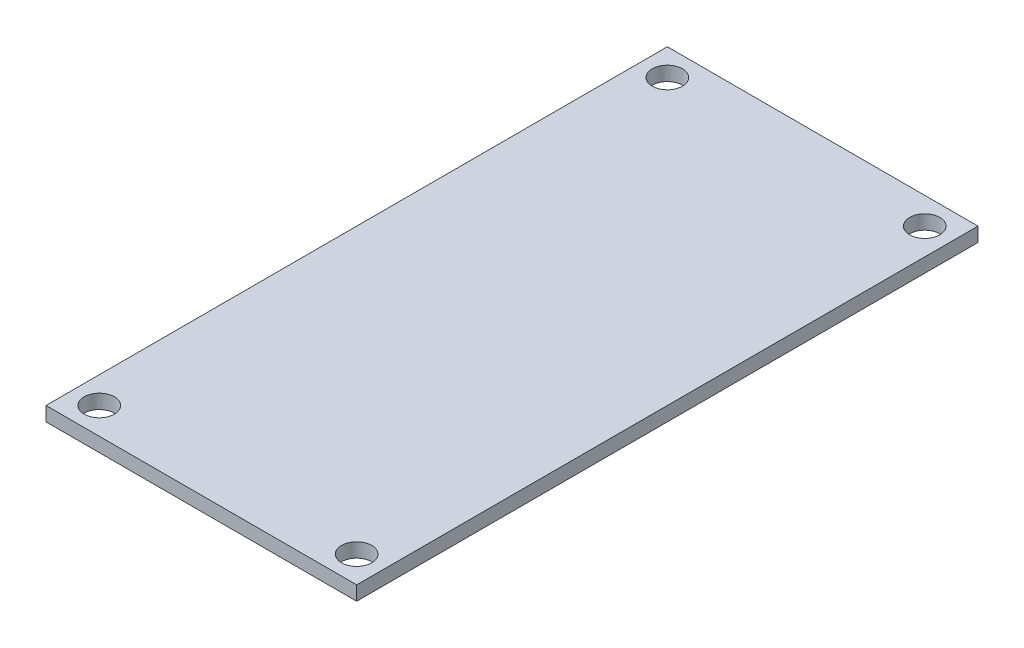
from build123d import *

# Parameters (mm, degrees)
SKETCH1_W           = 35
SKETCH1_H           = 70
SKETCH1_R           = 1.7
BOSS_EXTRUDE1_DEPTH = 1.6


with BuildPart() as part:
    # Sketch1 → Boss-Extrude1 (new body)
    with BuildSketch(Plane(origin=(0, 0, 0), x_dir=(1, 0, 0), z_dir=(0, 1, 0))):
        with Locations((17.5, 35)):
            Rectangle(SKETCH1_W, SKETCH1_H)
        with Locations(Location((3, 3, 0), (0, 0, 270))):
            Circle(SKETCH1_R, mode=Mode.SUBTRACT)
        with Locations(Location((32, 3, 0), (0, 0, 270))):
            Circle(SKETCH1_R, mode=Mode.SUBTRACT)
        with Locations(Location((3, 67, 0), (0, 0, 270))):
            Circle(SKETCH1_R, mode=Mode.SUBTRACT)
        with Locations(Location((32, 67, 0), (0, 0, 270))):
            Circle(SKETCH1_R, mode=Mode.SUBTRACT)
    extrude(amount=BOSS_EXTRUDE1_DEPTH)


solid = part.part
